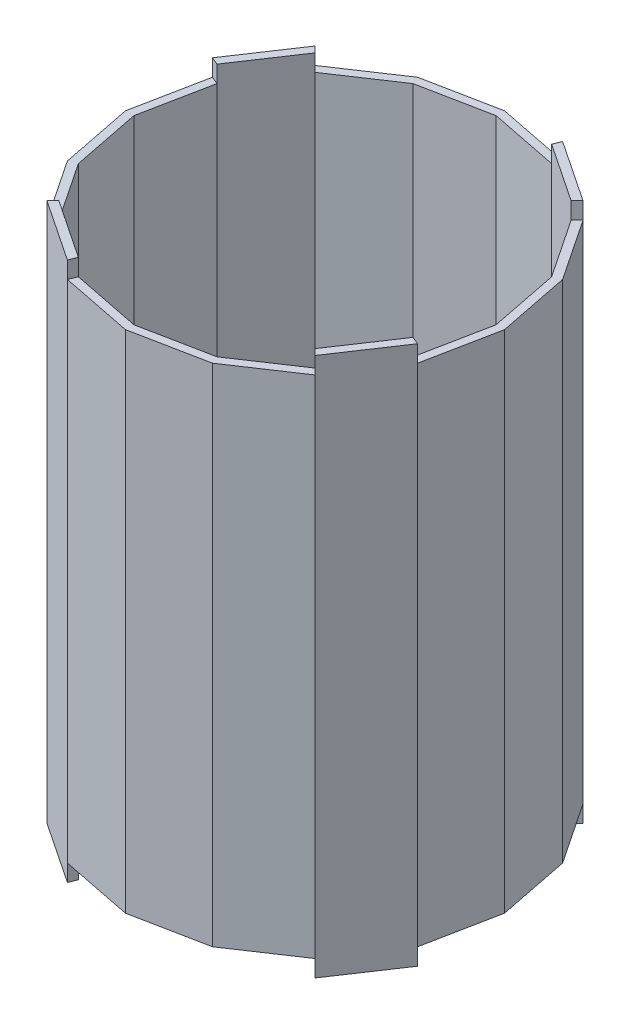
from build123d import *

# Parameters (mm, degrees)
BOSS_EXTRUDE1_DEPTH = 152.4
BOSS_EXTRUDE2_DEPTH = 5.08
BOSS_EXTRUDE3_DEPTH = 5.08


with BuildPart() as part:
    # Sketch1 → Boss-Extrude1 (new body)
    with BuildSketch(Plane(origin=(0, 0, 0), x_dir=(1, 0, 0), z_dir=(0, 1, 0))):
        Polygon((-40.411152545, -40.411152545), (-21.87035816, -52.799715283), (0, -57.15), (21.87035816, -52.799715283), (40.411152545, -40.411152545), (52.799715283, -21.87035816), (57.15, 0), (52.799715283, 21.87035816), (40.411152545, 40.411152545), (21.87035816, 52.799715283), (0, 57.15), (-21.87035816, 52.799715283), (-40.411152545, 40.411152545), (-52.799715283, 21.87035816), (-57.15, 0), (-52.799715283, -21.87035816), align=None)
        Polygon((0, 54.61), (-20.898342241, 50.45306127), (-38.615101321, 38.615101321), (-50.45306127, 20.898342241), (-54.61, 0), (-50.45306127, -20.898342241), (-38.615101321, -38.615101321), (-20.898342241, -50.45306127), (0, -54.61), (20.898342241, -50.45306127), (38.615101321, -38.615101321), (50.45306127, -20.898342241), (54.61, 0), (50.45306127, 20.898342241), (38.615101321, 38.615101321), (20.898342241, 50.45306127), align=None, mode=Mode.SUBTRACT)
    extrude(amount=BOSS_EXTRUDE1_DEPTH)

    # Sketch2 → Boss-Extrude2 (add)
    with BuildSketch(Plane(origin=(0, 152.4, 0), x_dir=(1, 0, 0), z_dir=(0, 1, 0))):
        Polygon((-52.799715283, 21.87035816), (-50.45306127, 20.898342241), (-38.615101321, 38.615101321), (-40.411152545, 40.411152545), align=None)
        Polygon((-38.615101321, -38.615101321), (-20.898342241, -50.45306127), (-21.87035816, -52.799715283), (-40.411152545, -40.411152545), align=None)
        Polygon((38.615101321, -38.615101321), (40.411152545, -40.411152545), (52.799715283, -21.87035816), (50.45306127, -20.898342241), align=None)
        Polygon((40.411152545, 40.411152545), (38.615101321, 38.615101321), (20.898342241, 50.45306127), (21.87035816, 52.799715283), align=None)
    extrude(amount=BOSS_EXTRUDE2_DEPTH)

    # Sketch3 → Boss-Extrude3 (add)
    with BuildSketch(Plane.XZ):
        Polygon((38.615101321, -38.615101321), (40.411152545, -40.411152545), (21.87035816, -52.799715283), (20.898342241, -50.45306127), align=None)
        Polygon((50.45306127, 20.898342241), (52.799715283, 21.87035816), (40.411152545, 40.411152545), (38.615101321, 38.615101321), align=None)
        Polygon((-40.411152545, 40.411152545), (-38.615101321, 38.615101321), (-20.898342241, 50.45306127), (-21.87035816, 52.799715283), align=None)
        Polygon((-50.45306127, -20.898342241), (-38.615101321, -38.615101321), (-40.411152545, -40.411152545), (-52.799715283, -21.87035816), align=None)
    extrude(amount=BOSS_EXTRUDE3_DEPTH)


solid = part.part
